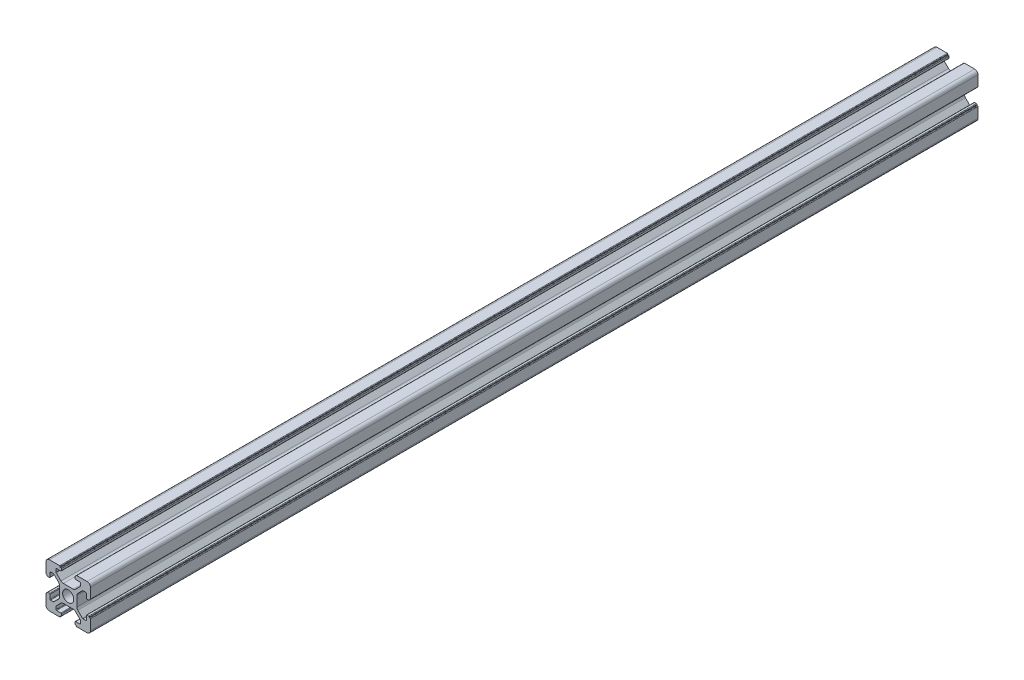
from build123d import *

# Parameters (mm, degrees)
SKETCH_1_R      = 2.5
EXTRUDE_1_DEPTH = 400


with BuildPart() as part:
    # 草图1 → 凸台-拉伸1 (new body)
    with BuildSketch(Plane.XY):
        with BuildLine():
            Line((-8.502261885, -10.002261885), (-3.85, -10.002261885))
            ThreePointArc((-3.85, -10.002261885), (-3.673223305, -9.929038581), (-3.6, -9.752261885))
            Line((-3.6, -9.752261885), (-3.6, -9.502261885))
            Line((-3.6, -9.502261885), (-3.35, -9.502261885))
            ThreePointArc((-3.35, -9.502261885), (-3.173223305, -9.429038581), (-3.1, -9.252261885))
            Line((-3.1, -9.252261885), (-3.1, -8.45))
            ThreePointArc((-3.1, -8.45), (-3.173223305, -8.273223305), (-3.35, -8.2))
            Line((-3.35, -8.2), (-5.25, -8.2))
            ThreePointArc((-5.25, -8.2), (-5.426776695, -8.126776695), (-5.5, -7.95))
            Line((-5.5, -7.95), (-5.5, -6.664213562))
            ThreePointArc((-5.5, -6.664213562), (-5.480969883, -6.568542704), (-5.426776695, -6.487436867))
            Line((-5.426776695, -6.487436867), (-3.278679656, -4.339339828))
            ThreePointArc((-3.278679656, -4.339339828), (-2.792044633, -4.014180701), (-2.218019485, -3.9))
            Line((-2.218019485, -3.9), (2.218019485, -3.9))
            ThreePointArc((2.218019485, -3.9), (2.792044633, -4.014180701), (3.278679656, -4.339339828))
            Line((3.278679656, -4.339339828), (5.426776695, -6.487436867))
            ThreePointArc((5.426776695, -6.487436867), (5.480969883, -6.568542704), (5.5, -6.664213562))
            Line((5.5, -6.664213562), (5.5, -7.95))
            ThreePointArc((5.5, -7.95), (5.426776695, -8.126776695), (5.25, -8.2))
            Line((5.25, -8.2), (3.35, -8.2))
            ThreePointArc((3.35, -8.2), (3.173223305, -8.273223305), (3.1, -8.45))
            Line((3.1, -8.45), (3.1, -9.252261885))
            ThreePointArc((3.1, -9.252261885), (3.173223305, -9.429038581), (3.35, -9.502261885))
            Line((3.35, -9.502261885), (3.6, -9.502261885))
            Line((3.6, -9.502261885), (3.6, -9.752261885))
            ThreePointArc((3.6, -9.752261885), (3.673223305, -9.929038581), (3.85, -10.002261885))
            Line((3.85, -10.002261885), (8.502261885, -10.002261885))
            ThreePointArc((8.502261885, -10.002261885), (9.562922057, -9.562922057), (10.002261885, -8.502261885))
            Line((10.002261885, -8.502261885), (10.002261885, -3.85))
            ThreePointArc((10.002261885, -3.85), (9.929038581, -3.673223305), (9.752261885, -3.6))
            Line((9.752261885, -3.6), (9.502261885, -3.6))
            Line((9.502261885, -3.6), (9.502261885, -3.35))
            ThreePointArc((9.502261885, -3.35), (9.429038581, -3.173223305), (9.252261885, -3.1))
            Line((9.252261885, -3.1), (8.45, -3.1))
            ThreePointArc((8.45, -3.1), (8.273223305, -3.173223305), (8.2, -3.35))
            Line((8.2, -3.35), (8.2, -5.25))
            ThreePointArc((8.2, -5.25), (8.126776695, -5.426776695), (7.95, -5.5))
            Line((7.95, -5.5), (6.664213562, -5.5))
            ThreePointArc((6.664213562, -5.5), (6.568542704, -5.480969883), (6.487436867, -5.426776695))
            Line((6.487436867, -5.426776695), (4.339339828, -3.278679656))
            ThreePointArc((4.339339828, -3.278679656), (4.014180701, -2.792044633), (3.9, -2.218019485))
            Line((3.9, -2.218019485), (3.9, 2.218019485))
            ThreePointArc((3.9, 2.218019485), (4.014180701, 2.792044633), (4.339339828, 3.278679656))
            Line((4.339339828, 3.278679656), (6.487436867, 5.426776695))
            ThreePointArc((6.487436867, 5.426776695), (6.568542704, 5.480969883), (6.664213562, 5.5))
            Line((6.664213562, 5.5), (7.95, 5.5))
            ThreePointArc((7.95, 5.5), (8.126776695, 5.426776695), (8.2, 5.25))
            Line((8.2, 5.25), (8.2, 3.35))
            ThreePointArc((8.2, 3.35), (8.273223305, 3.173223305), (8.45, 3.1))
            Line((8.45, 3.1), (9.252261885, 3.1))
            ThreePointArc((9.252261885, 3.1), (9.429038581, 3.173223305), (9.502261885, 3.35))
            Line((9.502261885, 3.35), (9.502261885, 3.6))
            Line((9.502261885, 3.6), (9.752261885, 3.6))
            ThreePointArc((9.752261885, 3.6), (9.929038581, 3.673223305), (10.002261885, 3.85))
            Line((10.002261885, 3.85), (10.002261885, 8.502261885))
            ThreePointArc((10.002261885, 8.502261885), (9.562922057, 9.562922057), (8.502261885, 10.002261885))
            Line((8.502261885, 10.002261885), (3.85, 10.002261885))
            ThreePointArc((3.85, 10.002261885), (3.673223305, 9.929038581), (3.6, 9.752261885))
            Line((3.6, 9.752261885), (3.6, 9.502261885))
            Line((3.6, 9.502261885), (3.35, 9.502261885))
            ThreePointArc((3.35, 9.502261885), (3.173223305, 9.429038581), (3.1, 9.252261885))
            Line((3.1, 9.252261885), (3.1, 8.45))
            ThreePointArc((3.1, 8.45), (3.173223305, 8.273223305), (3.35, 8.2))
            Line((3.35, 8.2), (5.25, 8.2))
            ThreePointArc((5.25, 8.2), (5.426776695, 8.126776695), (5.5, 7.95))
            Line((5.5, 7.95), (5.5, 6.664213562))
            ThreePointArc((5.5, 6.664213562), (5.480969883, 6.568542704), (5.426776695, 6.487436867))
            Line((5.426776695, 6.487436867), (3.278679656, 4.339339828))
            ThreePointArc((3.278679656, 4.339339828), (2.792044633, 4.014180701), (2.218019485, 3.9))
            Line((2.218019485, 3.9), (-2.218019485, 3.9))
            ThreePointArc((-2.218019485, 3.9), (-2.792044633, 4.014180701), (-3.278679656, 4.339339828))
            Line((-3.278679656, 4.339339828), (-5.426776695, 6.487436867))
            ThreePointArc((-5.426776695, 6.487436867), (-5.480969883, 6.568542704), (-5.5, 6.664213562))
            Line((-5.5, 6.664213562), (-5.5, 7.95))
            ThreePointArc((-5.5, 7.95), (-5.426776695, 8.126776695), (-5.25, 8.2))
            Line((-5.25, 8.2), (-3.35, 8.2))
            ThreePointArc((-3.35, 8.2), (-3.173223305, 8.273223305), (-3.1, 8.45))
            Line((-3.1, 8.45), (-3.1, 9.252261885))
            ThreePointArc((-3.1, 9.252261885), (-3.173223305, 9.429038581), (-3.35, 9.502261885))
            Line((-3.35, 9.502261885), (-3.6, 9.502261885))
            Line((-3.6, 9.502261885), (-3.6, 9.752261885))
            ThreePointArc((-3.6, 9.752261885), (-3.673223305, 9.929038581), (-3.85, 10.002261885))
            Line((-3.85, 10.002261885), (-8.502261885, 10.002261885))
            ThreePointArc((-8.502261885, 10.002261885), (-9.562922057, 9.562922057), (-10.002261885, 8.502261885))
            Line((-10.002261885, 8.502261885), (-10.002261885, 3.85))
            ThreePointArc((-10.002261885, 3.85), (-9.929038581, 3.673223305), (-9.752261885, 3.6))
            Line((-9.752261885, 3.6), (-9.502261885, 3.6))
            Line((-9.502261885, 3.6), (-9.502261885, 3.35))
            ThreePointArc((-9.502261885, 3.35), (-9.429038581, 3.173223305), (-9.252261885, 3.1))
            Line((-9.252261885, 3.1), (-8.45, 3.1))
            ThreePointArc((-8.45, 3.1), (-8.273223305, 3.173223305), (-8.2, 3.35))
            Line((-8.2, 3.35), (-8.2, 5.25))
            ThreePointArc((-8.2, 5.25), (-8.126776695, 5.426776695), (-7.95, 5.5))
            Line((-7.95, 5.5), (-6.664213562, 5.5))
            ThreePointArc((-6.664213562, 5.5), (-6.568542704, 5.480969883), (-6.487436867, 5.426776695))
            Line((-6.487436867, 5.426776695), (-4.339339828, 3.278679656))
            ThreePointArc((-4.339339828, 3.278679656), (-4.014180701, 2.792044633), (-3.9, 2.218019485))
            Line((-3.9, 2.218019485), (-3.9, -2.218019485))
            ThreePointArc((-3.9, -2.218019485), (-4.014180701, -2.792044633), (-4.339339828, -3.278679656))
            Line((-4.339339828, -3.278679656), (-6.487436867, -5.426776695))
            ThreePointArc((-6.487436867, -5.426776695), (-6.568542704, -5.480969883), (-6.664213562, -5.5))
            Line((-6.664213562, -5.5), (-7.95, -5.5))
            ThreePointArc((-7.95, -5.5), (-8.126776695, -5.426776695), (-8.2, -5.25))
            Line((-8.2, -5.25), (-8.2, -3.35))
            ThreePointArc((-8.2, -3.35), (-8.273223305, -3.173223305), (-8.45, -3.1))
            Line((-8.45, -3.1), (-9.252261885, -3.1))
            ThreePointArc((-9.252261885, -3.1), (-9.429038581, -3.173223305), (-9.502261885, -3.35))
            Line((-9.502261885, -3.35), (-9.502261885, -3.6))
            Line((-9.502261885, -3.6), (-9.752261885, -3.6))
            ThreePointArc((-9.752261885, -3.6), (-9.929038581, -3.673223305), (-10.002261885, -3.85))
            Line((-10.002261885, -3.85), (-10.002261885, -8.502261885))
            ThreePointArc((-10.002261885, -8.502261885), (-9.562922057, -9.562922057), (-8.502261885, -10.002261885))
        make_face()
        Circle(SKETCH_1_R, mode=Mode.SUBTRACT)
    extrude(amount=EXTRUDE_1_DEPTH)


solid = part.part
